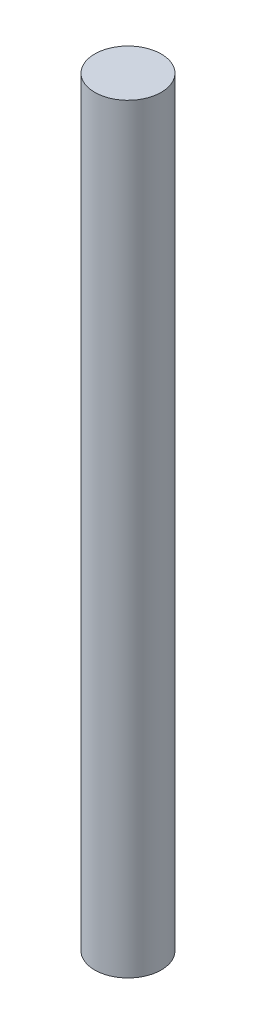
from build123d import *

# Parameters (mm, degrees)
SKETCH_1_R      = 1.75
EXTRUDE_1_DEPTH = 40


with BuildPart() as part:
    # 草图1 → 凸台-拉伸1 (new body)
    with BuildSketch(Plane(origin=(0, 0, 0), x_dir=(1, 0, 0), z_dir=(0, 1, 0))):
        with Locations(Location((0, 0, 0), (0, 0, 270))):
            Circle(SKETCH_1_R)
    extrude(amount=EXTRUDE_1_DEPTH)


solid = part.part
